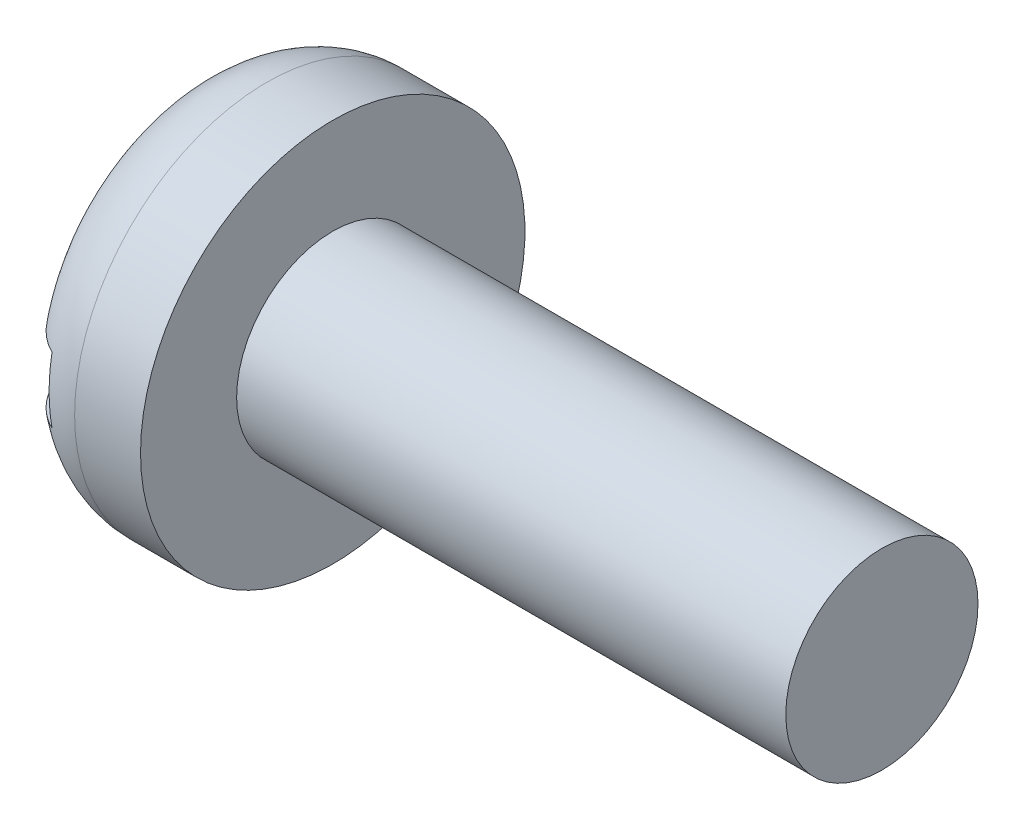
from build123d import *

# Parameters (mm, degrees)
SKETCH2_W  = 7
SKETCH2_H  = 1.2
SLOT_DEPTH = 0.8


with BuildPart() as part:
    # BodySke → Base-Revolve (revolve)
    with BuildSketch(Plane.XY, mode=Mode.PRIVATE) as base_revolve_sk:
        with BuildLine():
            Line((2.6, 1.75), (2.6, 3.5))
            Line((2.6, 3.5), (1.4, 3.5))
            ThreePointArc((1.4, 3.5), (0.410050506, 3.089949494), (0, 2.1))
            Line((0, 2.1), (0, 0))
            Line((0, 0), (12.6, 0))
            Line((12.6, 0), (12.6, 1.75))
            Line((12.6, 1.75), (2.6, 1.75))
        make_face()
    revolve(base_revolve_sk.sketch.rotate(Axis((-25.4, 0, 0), (1, 0, 0)), 90), axis=Axis((-25.4, 0, 0), (1, 0, 0)))

    # Sketch2 → Slot (cut)
    with BuildSketch(Plane(origin=(0, 0, 0), x_dir=(0, 0, -1), z_dir=(1, 0, 0))):
        Rectangle(SKETCH2_W, SKETCH2_H)
    extrude(amount=SLOT_DEPTH, mode=Mode.SUBTRACT)


solid = part.part
